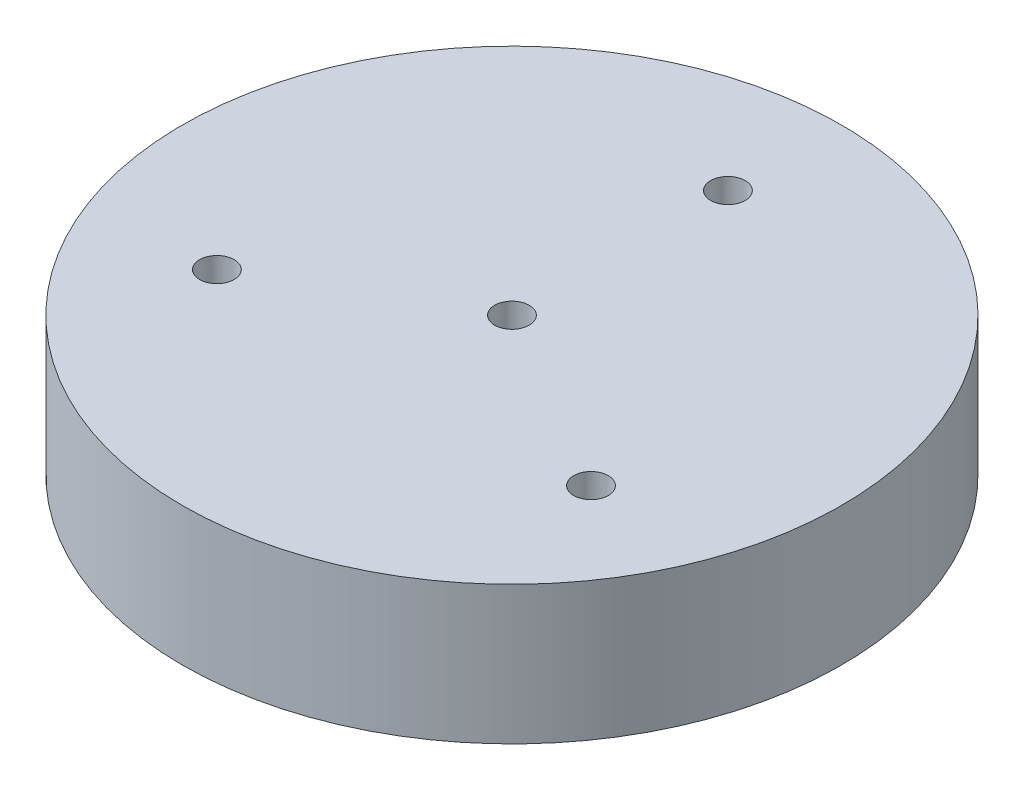
from build123d import *

# Parameters (mm, degrees)
SKETCH1_R           = 76.29
BOSS_EXTRUDE1_DEPTH = 32
SKETCH2_R           = 4
CUT_EXTRUDE1_DEPTH  = 113.535897384
CIRPATTERN1_COUNT   = 3
SKETCH3_R           = 4
CUT_EXTRUDE2_DEPTH  = 113.535897384


with BuildPart() as part:
    # Sketch1 → Boss-Extrude1 (new body)
    with BuildSketch(Plane(origin=(0, 0, 0), x_dir=(1, 0, 0), z_dir=(0, 1, 0))):
        Circle(SKETCH1_R)
    extrude(amount=BOSS_EXTRUDE1_DEPTH)

    # Sketch2 → Cut-Extrude1 (cut, through all)
    with BuildSketch(Plane(origin=(0, 32, 0), x_dir=(1, 0, 0), z_dir=(0, 1, 0))):
        with Locations((0, 50)):
            Circle(SKETCH2_R)
    cut_extrude1 = extrude(amount=-CUT_EXTRUDE1_DEPTH, mode=Mode.SUBTRACT)

    # CirPattern1: Cut-Extrude1 ×3 about axis
    cirpattern1_axis = Axis((0, 33.6, 0), (0, -1, 0))
    for i in range(1, CIRPATTERN1_COUNT):
        add(cut_extrude1.rotate(cirpattern1_axis, i * 360 / CIRPATTERN1_COUNT), mode=Mode.SUBTRACT)

    # Sketch3 → Cut-Extrude2 (cut, through all)
    with BuildSketch(Plane(origin=(0, 32, 0), x_dir=(1, 0, 0), z_dir=(0, 1, 0))):
        Circle(SKETCH3_R)
    extrude(amount=-CUT_EXTRUDE2_DEPTH, mode=Mode.SUBTRACT)


solid = part.part
